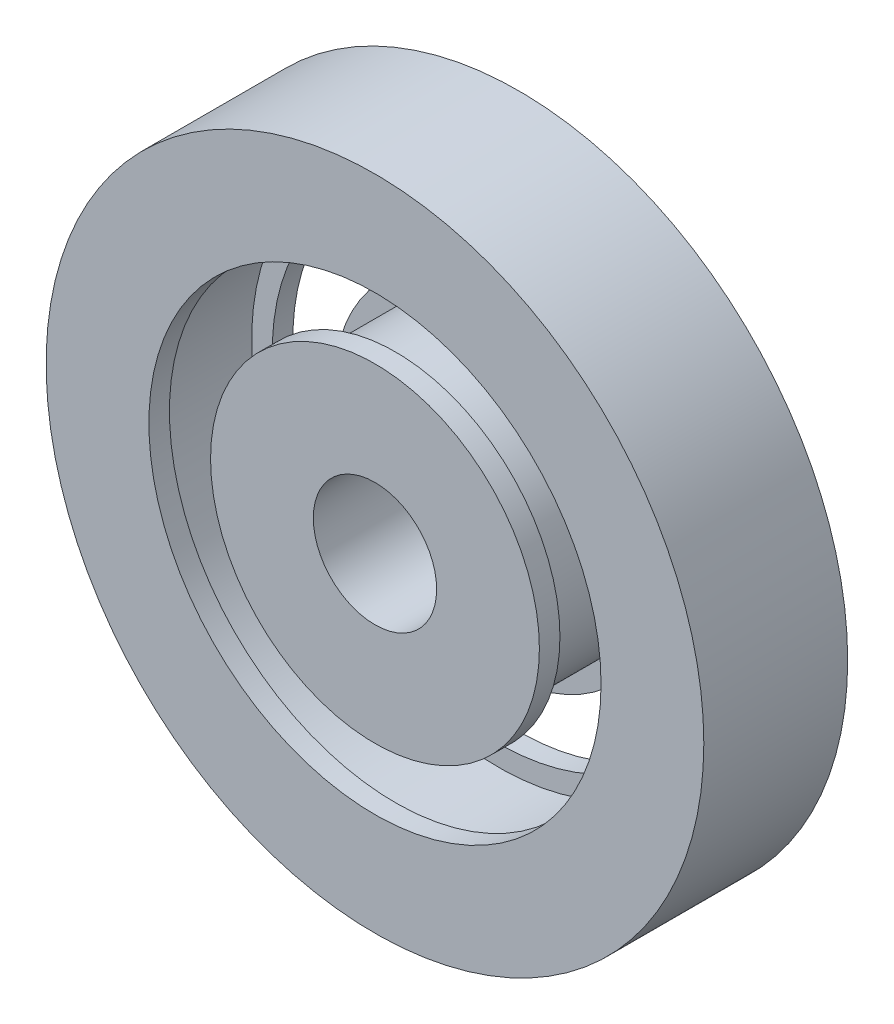
from build123d import *

# Parameters (mm, degrees)
SKETCH1_R           = 32
BOSS_EXTRUDE1_DEPTH = 14
SKETCH2_R           = 24
SKETCH2_R_2         = 14
CUT_EXTRUDE1_DEPTH  = 12
SKETCH3_R           = 16
SKETCH3_R_2         = 14
BOSS_EXTRUDE2_DEPTH = 2
SKETCH4_R           = 24
SKETCH4_R_2         = 22
BOSS_EXTRUDE3_DEPTH = 2
SKETCH5_R           = 22
SKETCH5_R_2         = 16
CUT_EXTRUDE2_DEPTH  = 68
SKETCH6_R           = 6
CUT_EXTRUDE3_DEPTH  = 68


with BuildPart() as part:
    # Sketch1 → Boss-Extrude1 (new body)
    with BuildSketch(Plane.XY):
        Circle(SKETCH1_R)
    extrude(amount=BOSS_EXTRUDE1_DEPTH)

    # Sketch2 → Cut-Extrude1 (cut)
    with BuildSketch(Plane.XY.offset(14)):
        Circle(SKETCH2_R)
        Circle(SKETCH2_R_2, mode=Mode.SUBTRACT)
    extrude(amount=-CUT_EXTRUDE1_DEPTH, mode=Mode.SUBTRACT)

    # Sketch3 → Boss-Extrude2 (add)
    with BuildSketch(Plane.XY.offset(14)):
        Circle(SKETCH3_R)
        Circle(SKETCH3_R_2, mode=Mode.SUBTRACT)
    extrude(amount=-BOSS_EXTRUDE2_DEPTH)

    # Sketch4 → Boss-Extrude3 (add)
    with BuildSketch(Plane.XY.offset(14)):
        Circle(SKETCH4_R)
        Circle(SKETCH4_R_2, mode=Mode.SUBTRACT)
    extrude(amount=-BOSS_EXTRUDE3_DEPTH)

    # Sketch5 → Cut-Extrude2 (cut)
    with BuildSketch(Plane.XY.offset(14)):
        Circle(SKETCH5_R)
        Circle(SKETCH5_R_2, mode=Mode.SUBTRACT)
    extrude(amount=-CUT_EXTRUDE2_DEPTH, mode=Mode.SUBTRACT)


with BuildPart() as cut_extrude2_piece_1:
    # of the separate pieces the step leaves, piece 1, a body of its own (cut_extrude2_pieces)
    add(part.part.solids().sort_by_distance((32, 0, 0))[0])


with BuildPart() as cut_extrude2_piece_2:
    # of the separate pieces the step leaves, piece 2, a body of its own (cut_extrude2_pieces)
    add(part.part.solids().sort_by_distance((16, 0, 0))[0])

    # Sketch6 → Cut-Extrude3 (cut)
    with BuildSketch(Plane(origin=(0, 0, 0), x_dir=(-1, 0, 0), z_dir=(0, 0, -1))):
        Circle(SKETCH6_R)
    extrude(amount=-CUT_EXTRUDE3_DEPTH, mode=Mode.SUBTRACT)


solid = Compound([cut_extrude2_piece_1.part, cut_extrude2_piece_2.part])
